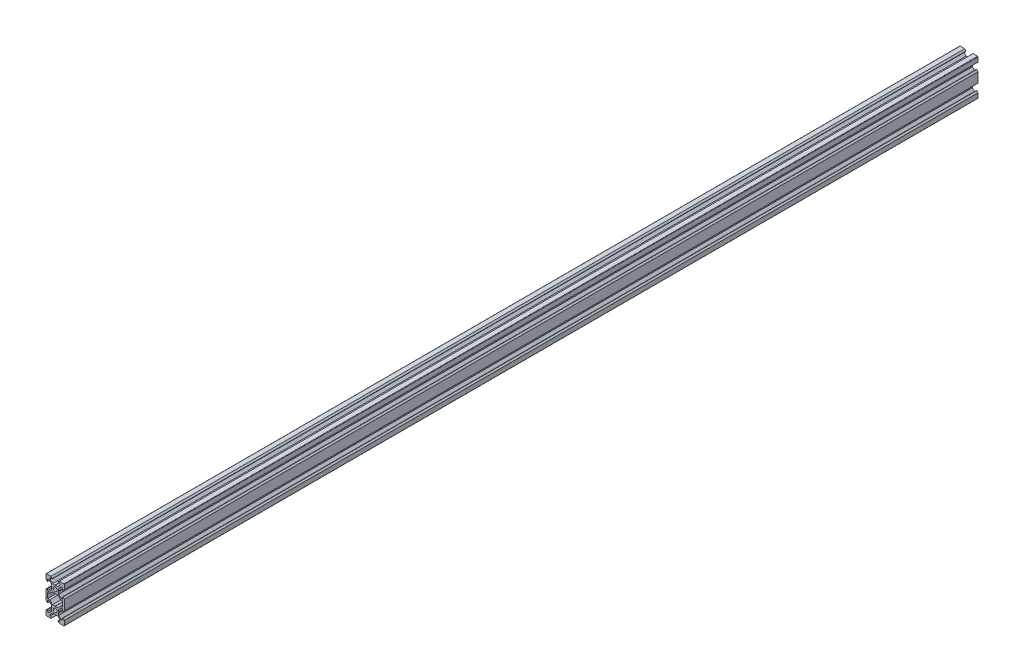
from build123d import *

# Parameters (mm, degrees)
SKETCH1_R           = 2.1
BOSS_EXTRUDE1_DEPTH = 1000
FILLET1_R           = 0.5


with BuildPart() as part:
    # Sketch1 → Boss-Extrude1 (new body)
    with BuildSketch(Plane.XY):
        Polygon((2.839339828, 13.9), (5.5, 16.560660172), (5.5, 18.2), (3.125, 18.2), (3.125, 18.545), (4.58, 20), (10, 20), (10, 14.58), (8.545, 13.125), (8.2, 13.125), (8.2, 15.5), (6.560660172, 15.5), (3.9, 12.839339828), (3.9, 10.2), (3.7, 10), (3.9, 9.8), (3.9, 7.160660172), (6.560660172, 4.5), (8.2, 4.5), (8.2, 6.875), (8.545, 6.875), (10, 5.42), (10, -5.42), (8.545, -6.875), (8.2, -6.875), (8.2, -4.5), (6.560660172, -4.5), (3.9, -7.160660172), (3.9, -9.8), (3.7, -10), (3.9, -10.2), (3.9, -12.839339828), (6.560660172, -15.5), (8.2, -15.5), (8.2, -13.125), (8.545, -13.125), (10, -14.58), (10, -20), (4.58, -20), (3.125, -18.545), (3.125, -18.2), (5.5, -18.2), (5.5, -16.560660172), (2.839339828, -13.9), (0.2, -13.9), (0, -13.7), (-0.2, -13.9), (-2.839339828, -13.9), (-5.5, -16.560660172), (-5.5, -18.2), (-3.125, -18.2), (-3.125, -18.545), (-4.58, -20), (-10, -20), (-10, -14.58), (-8.545, -13.125), (-8.2, -13.125), (-8.2, -15.5), (-6.560660172, -15.5), (-3.9, -12.839339828), (-3.9, -10.2), (-3.7, -10), (-3.9, -9.8), (-3.9, -7.160660172), (-6.560660172, -4.5), (-8.2, -4.5), (-8.2, -6.875), (-8.545, -6.875), (-10, -5.42), (-10, 5.42), (-8.545, 6.875), (-8.2, 6.875), (-8.2, 4.5), (-6.560660172, 4.5), (-3.9, 7.160660172), (-3.9, 9.8), (-3.7, 10), (-3.9, 10.2), (-3.9, 12.839339828), (-6.560660172, 15.5), (-8.2, 15.5), (-8.2, 13.125), (-8.545, 13.125), (-10, 14.58), (-10, 20), (-4.58, 20), (-3.125, 18.545), (-3.125, 18.2), (-5.5, 18.2), (-5.5, 16.560660172), (-2.839339828, 13.9), (-0.2, 13.9), (0, 13.7), (0.2, 13.9), align=None)
        with Locations((0, 10)):
            Circle(SKETCH1_R, mode=Mode.SUBTRACT)
        with Locations((0, -10)):
            Circle(SKETCH1_R, mode=Mode.SUBTRACT)
        Polygon((8.2, -3), (8.2, 3), (5.939339828, 3), (2.839339828, 6.1), (0.2, 6.1), (0, 6.3), (-0.2, 6.1), (-2.839339828, 6.1), (-5.939339828, 3), (-8.2, 3), (-8.2, -3), (-5.939339828, -3), (-2.839339828, -6.1), (-0.2, -6.1), (0, -6.3), (0.2, -6.1), (2.839339828, -6.1), (5.939339828, -3), align=None, mode=Mode.SUBTRACT)
    extrude(amount=BOSS_EXTRUDE1_DEPTH)

    # Fillet1
    fillet1_edges = [part.edges().sort_by_distance(p)[0] for p in [
        (10, -20, 500),
        (-10, -20, 500),
        (-10, 20, 500),
        (10, 20, 500),
    ]]
    fillet(fillet1_edges, radius=FILLET1_R)


solid = part.part
